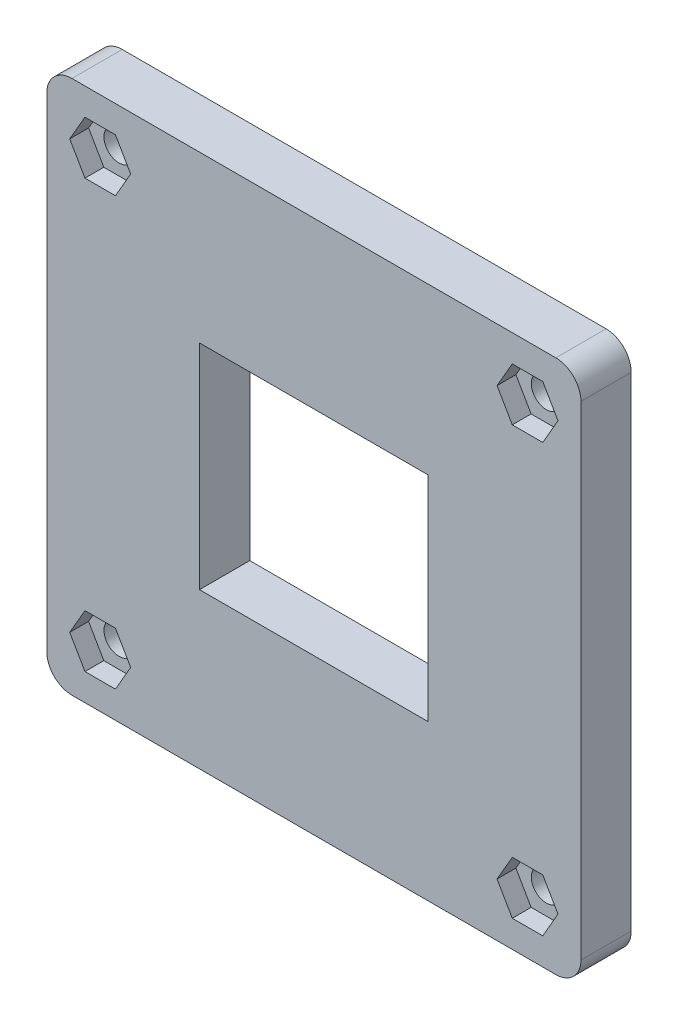
from build123d import *

# Parameters (mm, degrees)
SKETCH1_R           = 1.2
SKETCH1_W           = 18.2
SKETCH1_H           = 17
BOSS_EXTRUDE1_DEPTH = 4
CUT_EXTRUDE3_DEPTH  = 1
CUT_EXTRUDE4_DEPTH  = 1.5


with BuildPart() as part:
    # Sketch1 → Boss-Extrude1 (new body)
    with BuildSketch(Plane.XY):
        with BuildLine():
            Line((21.25, -19.25), (21.25, 19.25))
            ThreePointArc((21.25, 19.25), (20.664213562, 20.664213562), (19.25, 21.25))
            Line((19.25, 21.25), (-19.25, 21.25))
            ThreePointArc((-19.25, 21.25), (-20.664213562, 20.664213562), (-21.25, 19.25))
            Line((-21.25, 19.25), (-21.25, -19.25))
            ThreePointArc((-21.25, -19.25), (-20.664213562, -20.664213562), (-19.25, -21.25))
            Line((-19.25, -21.25), (19.25, -21.25))
            ThreePointArc((19.25, -21.25), (20.664213562, -20.664213562), (21.25, -19.25))
        make_face()
        with Locations((-17, -17)):
            Circle(SKETCH1_R, mode=Mode.SUBTRACT)
        with Locations((17, -17)):
            Circle(SKETCH1_R, mode=Mode.SUBTRACT)
        with Locations((17, 17)):
            Circle(SKETCH1_R, mode=Mode.SUBTRACT)
        with Locations((-17, 17)):
            Circle(SKETCH1_R, mode=Mode.SUBTRACT)
        with Locations((0, -0.4)):
            Rectangle(SKETCH1_W, SKETCH1_H, mode=Mode.SUBTRACT)
    extrude(amount=BOSS_EXTRUDE1_DEPTH)

    # Sketch2 → Cut-Extrude3 (cut)
    with BuildSketch(Plane(origin=(0, 0, 0), x_dir=(-1, 0, 0), z_dir=(0, 0, -1))):
        with BuildLine():
            Line((-9.5, 18.25), (9.5, 18.25))
            ThreePointArc((9.5, 18.25), (10.75, 17), (9.5, 15.75))
            Line((9.5, 15.75), (-9.5, 15.75))
            ThreePointArc((-9.5, 15.75), (-10.75, 17), (-9.5, 18.25))
        make_face()
    extrude(amount=-CUT_EXTRUDE3_DEPTH, mode=Mode.SUBTRACT)

    # Sketch3 → Cut-Extrude4 (cut)
    with BuildSketch(Plane.XY.offset(4)):
        Polygon((-18.212435565, -14.9), (-19.424871131, -17), (-18.212435565, -19.1), (-15.787564435, -19.1), (-14.575128869, -17), (-15.787564435, -14.9), align=None)
        Polygon((15.787564435, -14.9), (14.575128869, -17), (15.787564435, -19.1), (18.212435565, -19.1), (19.424871131, -17), (18.212435565, -14.9), align=None)
        Polygon((-18.212435565, 19.1), (-19.424871131, 17), (-18.212435565, 14.9), (-15.787564435, 14.9), (-14.575128869, 17), (-15.787564435, 19.1), align=None)
        Polygon((15.787564435, 19.1), (14.575128869, 17), (15.787564435, 14.9), (18.212435565, 14.9), (19.424871131, 17), (18.212435565, 19.1), align=None)
    extrude(amount=-CUT_EXTRUDE4_DEPTH, mode=Mode.SUBTRACT)


solid = part.part
